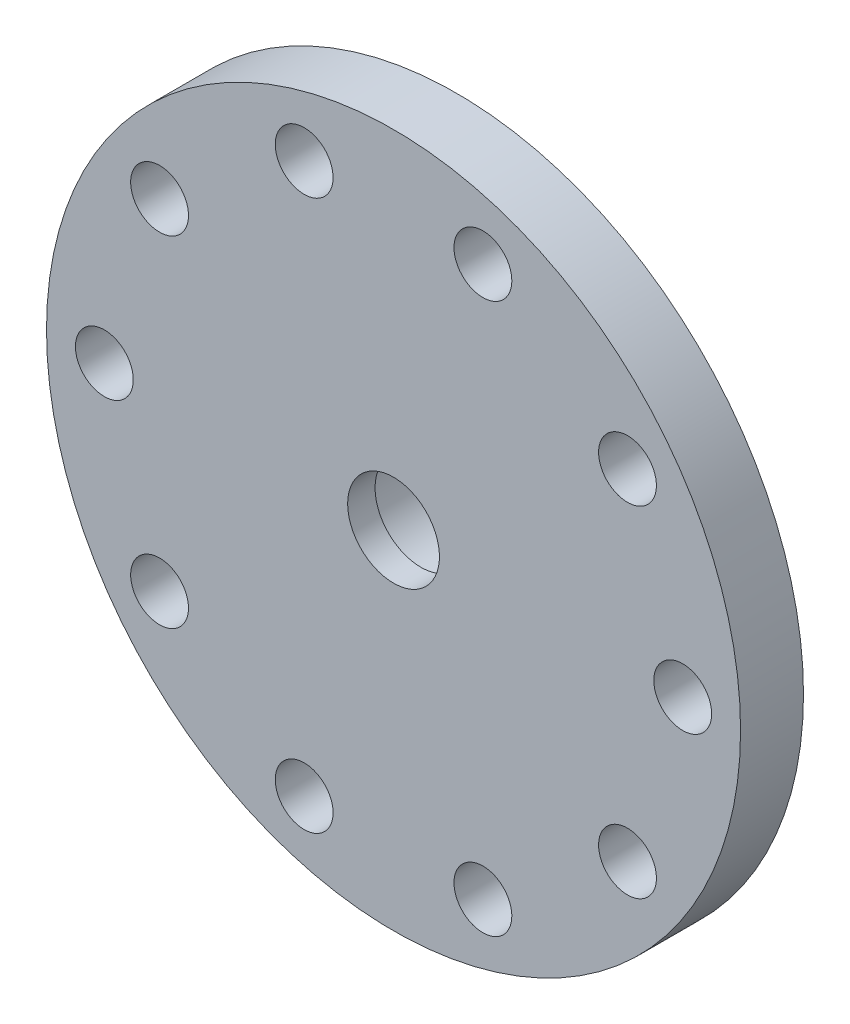
from build123d import *

# Parameters (mm, degrees)
FILLET1_R         = 1.5
HOLE1_D           = 5
CIRPATTERN1_COUNT = 10
HOLE2_D           = 7.936
HOLE2_CBORE_D     = 9.938
HOLE2_CBORE_DEPTH = 7.672
SKETCH7_W         = 3
SKETCH7_H         = 30


with BuildPart() as part:
    # Sketch1 → Revolve1 (revolve)
    with BuildSketch(Plane(origin=(0, 0, 0), x_dir=(1, 0, 0), z_dir=(0, 1, 0))):
        Polygon((0, 0), (-30, 0), (-30, 5.44), (-19.39, 5.44), (-19.39, 2.528275936), (-12.15, 6.81), (-12.15, 10.04), (0, 10.04), align=None)
    revolve(axis=Axis((0, 0, -10.04), (0, 0, 1)))

    # Fillet1
    fillet1_edges = [part.edges().sort_by_distance(p)[0] for p in [
        (19.39, 0, -2.528275936),
    ]]
    fillet(fillet1_edges, radius=FILLET1_R)

    # Hole1 (through all)
    with Locations(Plane(origin=(0, 0, -5.44), x_dir=(-1, 0, 0), z_dir=(0, 0, -1))):
        with Locations((-25, 0)):
            hole1 = Hole(HOLE1_D / 2)

    # CirPattern1: Hole1 ×10 about axis
    cirpattern1_axis = Axis((0, 0, 0), (0, 0, 1))
    for i in range(1, CIRPATTERN1_COUNT):
        add(hole1.rotate(cirpattern1_axis, i * 360 / CIRPATTERN1_COUNT), mode=Mode.SUBTRACT)

    # Hole2 (through all)
    with Locations(Plane(origin=(0, 0, -10.04), x_dir=(-1, 0, 0), z_dir=(0, 0, -1))):
        with Locations((0, 0)):
            CounterBoreHole(HOLE2_D / 2, HOLE2_CBORE_D / 2, HOLE2_CBORE_DEPTH)

    # Sketch7 → Hole3 (revolve, cut)
    with BuildSketch(Plane(origin=(0, 0, -10.04), x_dir=(0, 0, -1), z_dir=(1, 0, 0))):
        with Locations((1.5, 15)):
            Rectangle(SKETCH7_W, SKETCH7_H)
    revolve(axis=Axis((0, 110, -10.04), (0, -1, 0)), mode=Mode.SUBTRACT)


solid = part.part
